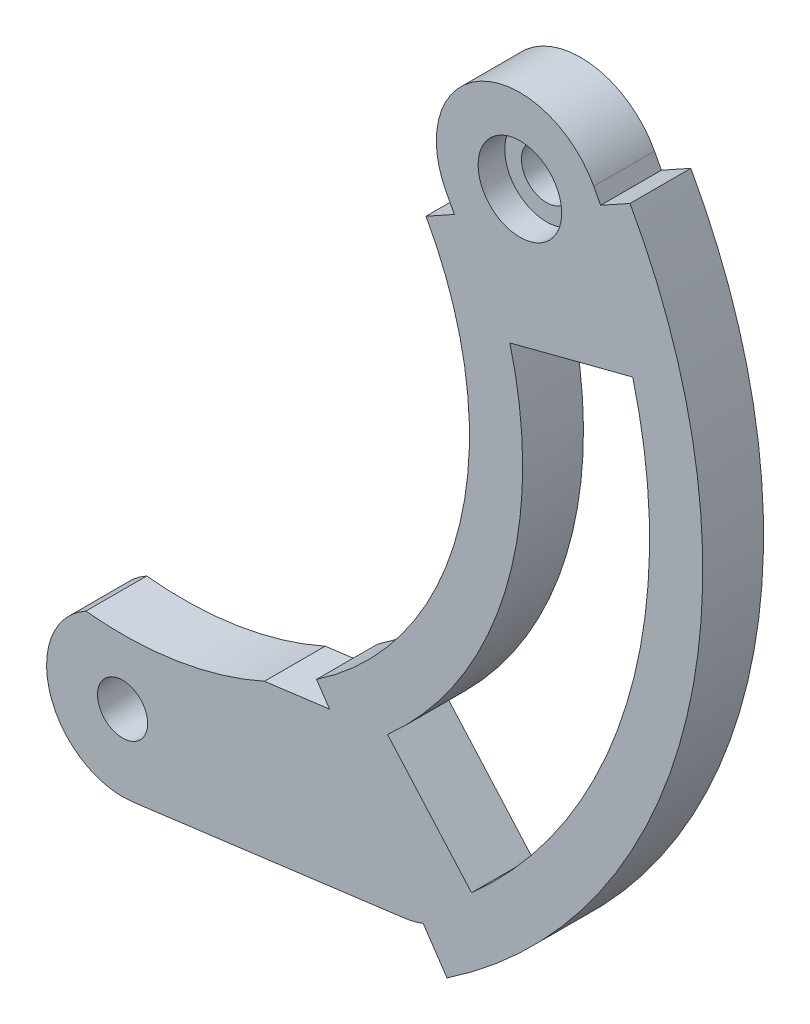
from build123d import *

# Parameters (mm, degrees)
F_01_EIGHT_MILLIMETRE_TRACK_BLANK_DEPTH        = 8
F_02_LOWER_CAGE_TIE_LANDING_DEPTH              = 8
F_03_BUMP_END_SUPPORT_LANDING_DEPTH            = 8
F_04_START                                     = -0.1
S04_RELIEF_FOR_THE_SWEPT_FLOATING_GUID_R       = 45.5
F_04_RELIEF_FOR_THE_SWEPT_FLOATING_GUIDE_DEPTH = 8.2
F_05_START                                     = -0.1
F_05_CONCENTRIC_GUIDE_AND_TANGENT_STOP_F_DEPTH = 8.2
F_06_START                                     = -0.1
S06_SUPPORT_FASTENERS_R                        = 3.3
F_06_SUPPORT_FASTENERS_DEPTH                   = 8.2
F_07_START                                     = -0.1
S07_BUMP_END_SUPPORT_REGISTER_UNDERSID_R       = 5.06
F_07_BUMP_END_SUPPORT_REGISTER_UNDERSIDE_DEPTH = 1.35
F_08_START                                     = 4.5
S08_FLUSH_BUTTON_SCREW_COUNTERBORE_OUT_R       = 5.5
F_08_FLUSH_BUTTON_SCREW_COUNTERBORE_OUTB_DEPTH = 3.6


with BuildPart() as part:
    # S01 - Eight millimetre track blank → 01 - Eight millimetre track blank (new body)
    with BuildSketch(Plane.XY):
        with BuildLine():
            Line((25.527156043, -37.845565187), (42.69437818, -63.297018665))
            ThreePointArc((42.69437818, -63.297018665), (74.240443422, -17.82355353), (66.77721464, 37.015214506))
            Line((66.77721464, 37.015214506), (39.926389631, 22.131559164))
            ThreePointArc((39.926389631, 22.131559164), (44.388686866, -10.65678086), (25.527156043, -37.845565187))
        make_face()
    extrude(amount=F_01_EIGHT_MILLIMETRE_TRACK_BLANK_DEPTH)

    # S02 - Lower cage tie landing → 02 - Lower cage tie landing (add)
    with BuildSketch(Plane.XY):
        with BuildLine():
            Line((-1.286113116, -44.083049206), (34.568787274, -39.433085863))
            ThreePointArc((34.568787274, -39.433085863), (45.771851184, -48.063923541), (37.141013506, -59.266987451))
            Line((37.141013506, -59.266987451), (1.286113116, -63.916950794))
            ThreePointArc((1.286113116, -63.916950794), (-9.916950794, -55.286113116), (-1.286113116, -44.083049206))
        make_face()
    extrude(amount=F_02_LOWER_CAGE_TIE_LANDING_DEPTH)

    # S03 - Bump end support landing → 03 - Bump end support landing (add)
    with BuildSketch(Plane.XY):
        with BuildLine():
            Line((45.572351488, 20.615526776), (42.574781821, 26.253135379))
            ThreePointArc((42.574781821, 26.253135379), (47.123018152, 41.129746091), (61.999628864, 36.58150976))
            Line((61.999628864, 36.58150976), (64.997198531, 30.943901157))
            ThreePointArc((64.997198531, 30.943901157), (60.4489622, 16.067290445), (45.572351488, 20.615526776))
        make_face()
    extrude(amount=F_03_BUMP_END_SUPPORT_LANDING_DEPTH)

    # S04 - Relief for the swept floating guide barrels → 04 - Relief for the swept floating guide barrels (cut)
    with BuildSketch(Plane.XY.offset(F_04_START)):
        Circle(S04_RELIEF_FOR_THE_SWEPT_FLOATING_GUID_R)
    extrude(amount=F_04_RELIEF_FOR_THE_SWEPT_FLOATING_GUIDE_DEPTH, mode=Mode.SUBTRACT)

    # S05 - Concentric guide and tangent stop faces → 05 - Concentric guide and tangent stop faces (cut)
    with BuildSketch(Plane.XY.offset(F_05_START)):
        with BuildLine():
            Line((34.862224899, -39.454375867), (45.92013859, -51.968869257))
            ThreePointArc((45.92013859, -51.968869257), (66.319734826, -20.275977723), (67.130143118, 17.405929591))
            Line((67.130143118, 17.405929591), (50.9647013, 13.214451233))
            ThreePointArc((50.9647013, 13.214451233), (50.349445401, -15.393370254), (34.862224899, -39.454375867))
        make_face()
    extrude(amount=F_05_CONCENTRIC_GUIDE_AND_TANGENT_STOP_F_DEPTH, mode=Mode.SUBTRACT)

    # S06 - Support fasteners → 06 - Support fasteners (cut)
    with BuildSketch(Plane.XY.offset(F_06_START)):
        with Locations(Location((0, -54, 0), (0, 0, 180))):
            Circle(S06_SUPPORT_FASTENERS_R)
        with Locations(Location((52.287205343, 31.41732257, 0), (0, 0, 180))):
            Circle(S06_SUPPORT_FASTENERS_R)
    extrude(amount=F_06_SUPPORT_FASTENERS_DEPTH, mode=Mode.SUBTRACT)

    # S07 - Bump end support register underside → 07 - Bump end support register underside (cut)
    with BuildSketch(Plane.XY.offset(F_07_START)):
        with Locations(Location((52.287205343, 31.41732257, 0), (0, 0, 180))):
            Circle(S07_BUMP_END_SUPPORT_REGISTER_UNDERSID_R)
    extrude(amount=F_07_BUMP_END_SUPPORT_REGISTER_UNDERSIDE_DEPTH, mode=Mode.SUBTRACT)

    # S08 - Flush button screw counterbore outboard → 08 - Flush button screw counterbore outboard (cut)
    with BuildSketch(Plane.XY.offset(F_08_START)):
        with Locations(Location((52.287205343, 31.41732257, 0), (0, 0, 180))):
            Circle(S08_FLUSH_BUTTON_SCREW_COUNTERBORE_OUT_R)
    extrude(amount=F_08_FLUSH_BUTTON_SCREW_COUNTERBORE_OUTB_DEPTH, mode=Mode.SUBTRACT)


solid = part.part
